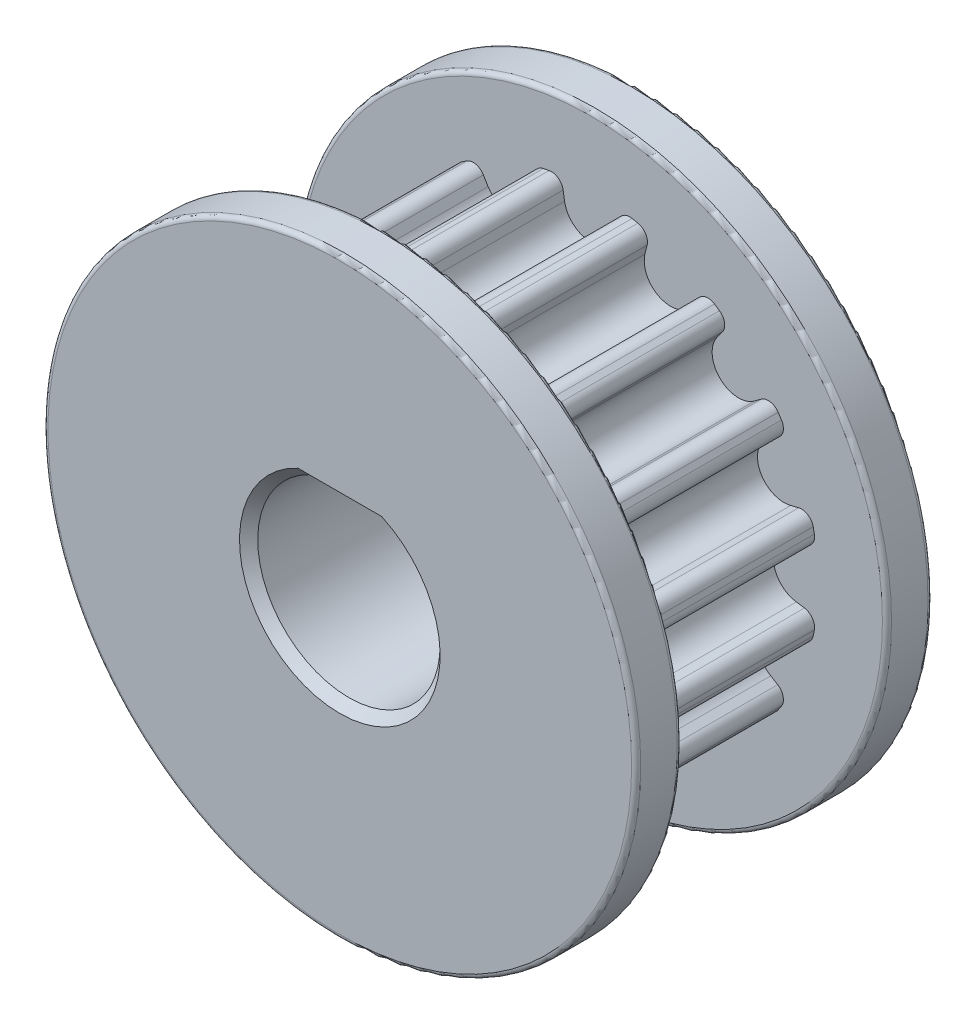
from build123d import *

# Parameters (mm, degrees)
EXTRUDE_3_DEPTH     = 4.5
SKETCH_5_R          = 6.5
EXTRUDE_4_DEPTH     = 1
EXTRUDE_START       = -5.5
SKETCH_5_2_R        = 6.5
EXTRUDE_6_DEPTH     = 1
CUT_EXTRUDE_1_REACH = 13.258
CHAMFER_1_SIZE      = 0.2
FILLET_1_R          = 0.1


with BuildPart() as part:
    # 草图1 → 凸台-拉伸3 (new body)
    with BuildSketch(Plane.XY):
        with BuildLine():
            Line((0.973500707, 4.894118549), (1.037379867, 4.881412194))
            ThreePointArc((1.037379867, 4.881412194), (1.206083752, 4.765877122), (1.239075855, 4.564082984))
            Line((1.239075855, 4.564082984), (1.190890986, 4.368931892))
            ThreePointArc((1.190890986, 4.368931892), (1.544766642, 3.700642421), (2.258591893, 3.950226689))
            Line((2.258591893, 3.950226689), (2.351135088, 4.103452967))
            ThreePointArc((2.351135088, 4.103452967), (2.517154032, 4.222814031), (2.718141325, 4.185218003))
            Line((2.718141325, 4.185218003), (2.772295463, 4.149033365))
            Line((2.772295463, 4.149033365), (2.8264496, 4.112848728))
            ThreePointArc((2.8264496, 4.112848728), (2.938098308, 3.941548058), (2.891355764, 3.742489052))
            Line((2.891355764, 3.742489052), (2.77215766, 3.580632503))
            ThreePointArc((2.77215766, 3.580632503), (2.843352827, 2.827791189), (3.59835313, 2.785207889))
            Line((3.59835313, 2.785207889), (3.742489052, 2.891355764))
            ThreePointArc((3.742489052, 2.891355764), (3.941548058, 2.938098308), (4.112848728, 2.8264496))
            Line((4.112848728, 2.8264496), (4.149033365, 2.772295463))
            Line((4.149033365, 2.772295463), (4.185218003, 2.718141325))
            ThreePointArc((4.185218003, 2.718141325), (4.222814031, 2.517154032), (4.103452967, 2.351135088))
            Line((4.103452967, 2.351135088), (3.931388459, 2.247214275))
            ThreePointArc((3.931388459, 2.247214275), (3.709064318, 1.524434383), (4.390297723, 1.196166436))
            Line((4.390297723, 1.196166436), (4.564082984, 1.239075855))
            ThreePointArc((4.564082984, 1.239075855), (4.765877122, 1.206083752), (4.881412194, 1.037379867))
            Line((4.881412194, 1.037379867), (4.894118549, 0.973500707))
            Line((4.894118549, 0.973500707), (4.906824904, 0.909621546))
            ThreePointArc((4.906824904, 0.909621546), (4.864644598, 0.709546123), (4.690836654, 0.60184212))
            Line((4.690836654, 0.60184212), (4.492101004, 0.571678044))
            ThreePointArc((4.492101004, 0.571678044), (4.010104391, -0.011003739), (4.513859285, -0.574980514))
            Line((4.513859285, -0.574980514), (4.690836654, -0.60184212))
            ThreePointArc((4.690836654, -0.60184212), (4.864644598, -0.709546123), (4.906824904, -0.909621546))
            Line((4.906824904, -0.909621546), (4.894118549, -0.973500707))
            Line((4.894118549, -0.973500707), (4.881412194, -1.037379867))
            ThreePointArc((4.881412194, -1.037379867), (4.765877122, -1.206083752), (4.564082984, -1.239075855))
            Line((4.564082984, -1.239075855), (4.368931892, -1.190890986))
            ThreePointArc((4.368931892, -1.190890986), (3.700642421, -1.544766642), (3.950226689, -2.258591893))
            Line((3.950226689, -2.258591893), (4.103452967, -2.351135088))
            ThreePointArc((4.103452967, -2.351135088), (4.222814031, -2.517154032), (4.185218003, -2.718141325))
            Line((4.185218003, -2.718141325), (4.149033365, -2.772295463))
            Line((4.149033365, -2.772295463), (4.112848728, -2.8264496))
            ThreePointArc((4.112848728, -2.8264496), (3.941548058, -2.938098308), (3.742489052, -2.891355764))
            Line((3.742489052, -2.891355764), (3.580632503, -2.77215766))
            ThreePointArc((3.580632503, -2.77215766), (2.827791189, -2.843352827), (2.785207889, -3.59835313))
            Line((2.785207889, -3.59835313), (2.891355764, -3.742489052))
            ThreePointArc((2.891355764, -3.742489052), (2.938098308, -3.941548058), (2.8264496, -4.112848728))
            Line((2.8264496, -4.112848728), (2.772295463, -4.149033365))
            Line((2.772295463, -4.149033365), (2.718141325, -4.185218003))
            ThreePointArc((2.718141325, -4.185218003), (2.517154032, -4.222814031), (2.351135088, -4.103452967))
            Line((2.351135088, -4.103452967), (2.247214275, -3.931388459))
            ThreePointArc((2.247214275, -3.931388459), (1.524434383, -3.709064318), (1.196166436, -4.390297723))
            Line((1.196166436, -4.390297723), (1.239075855, -4.564082984))
            ThreePointArc((1.239075855, -4.564082984), (1.206083752, -4.765877122), (1.037379867, -4.881412194))
            Line((1.037379867, -4.881412194), (0.973500707, -4.894118549))
            Line((0.973500707, -4.894118549), (0.909621546, -4.906824904))
            ThreePointArc((0.909621546, -4.906824904), (0.709546123, -4.864644598), (0.60184212, -4.690836654))
            Line((0.60184212, -4.690836654), (0.571678044, -4.492101004))
            ThreePointArc((0.571678044, -4.492101004), (-0.011003739, -4.010104391), (-0.574980514, -4.513859285))
            Line((-0.574980514, -4.513859285), (-0.60184212, -4.690836654))
            ThreePointArc((-0.60184212, -4.690836654), (-0.709546123, -4.864644598), (-0.909621546, -4.906824904))
            Line((-0.909621546, -4.906824904), (-0.973500707, -4.894118549))
            Line((-0.973500707, -4.894118549), (-1.037379867, -4.881412194))
            ThreePointArc((-1.037379867, -4.881412194), (-1.206083752, -4.765877122), (-1.239075855, -4.564082984))
            Line((-1.239075855, -4.564082984), (-1.190890986, -4.368931892))
            ThreePointArc((-1.190890986, -4.368931892), (-1.544766642, -3.700642421), (-2.258591893, -3.950226689))
            Line((-2.258591893, -3.950226689), (-2.351135088, -4.103452967))
            ThreePointArc((-2.351135088, -4.103452967), (-2.517154032, -4.222814031), (-2.718141325, -4.185218003))
            Line((-2.718141325, -4.185218003), (-2.772295463, -4.149033365))
            Line((-2.772295463, -4.149033365), (-2.8264496, -4.112848728))
            ThreePointArc((-2.8264496, -4.112848728), (-2.938098308, -3.941548058), (-2.891355764, -3.742489052))
            Line((-2.891355764, -3.742489052), (-2.77215766, -3.580632503))
            ThreePointArc((-2.77215766, -3.580632503), (-2.843352827, -2.827791189), (-3.59835313, -2.785207889))
            Line((-3.59835313, -2.785207889), (-3.742489052, -2.891355764))
            ThreePointArc((-3.742489052, -2.891355764), (-3.941548058, -2.938098308), (-4.112848728, -2.8264496))
            Line((-4.112848728, -2.8264496), (-4.149033365, -2.772295463))
            Line((-4.149033365, -2.772295463), (-4.185218003, -2.718141325))
            ThreePointArc((-4.185218003, -2.718141325), (-4.222814031, -2.517154032), (-4.103452967, -2.351135088))
            Line((-4.103452967, -2.351135088), (-3.931388459, -2.247214275))
            ThreePointArc((-3.931388459, -2.247214275), (-3.709064318, -1.524434383), (-4.390297723, -1.196166436))
            Line((-4.390297723, -1.196166436), (-4.564082984, -1.239075855))
            ThreePointArc((-4.564082984, -1.239075855), (-4.765877122, -1.206083752), (-4.881412194, -1.037379867))
            Line((-4.881412194, -1.037379867), (-4.894118549, -0.973500707))
            Line((-4.894118549, -0.973500707), (-4.906824904, -0.909621546))
            ThreePointArc((-4.906824904, -0.909621546), (-4.864644598, -0.709546123), (-4.690836654, -0.60184212))
            Line((-4.690836654, -0.60184212), (-4.492101004, -0.571678044))
            ThreePointArc((-4.492101004, -0.571678044), (-4.010104391, 0.011003739), (-4.513859285, 0.574980514))
            Line((-4.513859285, 0.574980514), (-4.690836654, 0.60184212))
            ThreePointArc((-4.690836654, 0.60184212), (-4.864644598, 0.709546123), (-4.906824904, 0.909621546))
            Line((-4.906824904, 0.909621546), (-4.894118549, 0.973500707))
            Line((-4.894118549, 0.973500707), (-4.881412194, 1.037379867))
            ThreePointArc((-4.881412194, 1.037379867), (-4.765877122, 1.206083752), (-4.564082984, 1.239075855))
            Line((-4.564082984, 1.239075855), (-4.368931892, 1.190890986))
            ThreePointArc((-4.368931892, 1.190890986), (-3.700642421, 1.544766642), (-3.950226689, 2.258591893))
            Line((-3.950226689, 2.258591893), (-4.103452967, 2.351135088))
            ThreePointArc((-4.103452967, 2.351135088), (-4.222814031, 2.517154032), (-4.185218003, 2.718141325))
            Line((-4.185218003, 2.718141325), (-4.149033365, 2.772295463))
            Line((-4.149033365, 2.772295463), (-4.112848728, 2.8264496))
            ThreePointArc((-4.112848728, 2.8264496), (-3.941548058, 2.938098308), (-3.742489052, 2.891355764))
            Line((-3.742489052, 2.891355764), (-3.580632503, 2.77215766))
            ThreePointArc((-3.580632503, 2.77215766), (-2.827791189, 2.843352827), (-2.785207889, 3.59835313))
            Line((-2.785207889, 3.59835313), (-2.891355764, 3.742489052))
            ThreePointArc((-2.891355764, 3.742489052), (-2.938098308, 3.941548058), (-2.8264496, 4.112848728))
            Line((-2.8264496, 4.112848728), (-2.772295463, 4.149033365))
            Line((-2.772295463, 4.149033365), (-2.718141325, 4.185218003))
            ThreePointArc((-2.718141325, 4.185218003), (-2.517154032, 4.222814031), (-2.351135088, 4.103452967))
            Line((-2.351135088, 4.103452967), (-2.247214275, 3.931388459))
            ThreePointArc((-2.247214275, 3.931388459), (-1.524434383, 3.709064318), (-1.196166436, 4.390297723))
            Line((-1.196166436, 4.390297723), (-1.239075855, 4.564082984))
            ThreePointArc((-1.239075855, 4.564082984), (-1.206083752, 4.765877122), (-1.037379867, 4.881412194))
            Line((-1.037379867, 4.881412194), (-0.973500707, 4.894118549))
            Line((-0.973500707, 4.894118549), (-0.909621546, 4.906824904))
            ThreePointArc((-0.909621546, 4.906824904), (-0.709546123, 4.864644598), (-0.60184212, 4.690836654))
            Line((-0.60184212, 4.690836654), (-0.571678044, 4.492101004))
            ThreePointArc((-0.571678044, 4.492101004), (0.011003739, 4.010104391), (0.574980514, 4.513859285))
            Line((0.574980514, 4.513859285), (0.60184212, 4.690836654))
            ThreePointArc((0.60184212, 4.690836654), (0.709546123, 4.864644598), (0.909621546, 4.906824904))
            Line((0.909621546, 4.906824904), (0.973500707, 4.894118549))
        make_face()
    extrude(amount=EXTRUDE_3_DEPTH)

    # 草图5 → 凸台-拉伸4 (add)
    with BuildSketch(Plane.XY.offset(4.5)):
        Circle(SKETCH_5_R)
    extrude(amount=EXTRUDE_4_DEPTH)

    # 草图5<2> → 凸台-拉伸6 (add)
    with BuildSketch(Plane.XY.offset(4.5).offset(EXTRUDE_START)):
        Circle(SKETCH_5_2_R)
    extrude(amount=EXTRUDE_6_DEPTH)

    # 草图6 → 切除-拉伸1 (cut, up to next)
    with BuildSketch(Plane.XY.offset(5.5), mode=Mode.PRIVATE) as cut_extrude_1_sk1:
        with BuildLine():
            Line((-0.871779789, 1.8), (0.871779789, 1.8))
            ThreePointArc((0.871779789, 1.8), (0, -2), (-0.871779789, 1.8))
        make_face()
    cut_extrude_1_tool1 = extrude(cut_extrude_1_sk1.sketch, amount=-CUT_EXTRUDE_1_REACH, mode=Mode.PRIVATE) & part.part
    add(cut_extrude_1_tool1.solids().sort_by_distance((0, -0.035819, 5.5))[0], mode=Mode.SUBTRACT)

    # 倒角1
    chamfer_1_edges = [part.edges().sort_by_distance(p)[0] for p in [
        (0, 1.8, -1),
        (0, -2, -1),
        (0, 1.8, 5.5),
        (0, -2, 5.5),
    ]]
    chamfer(chamfer_1_edges, length=CHAMFER_1_SIZE)

    # 圆角1
    fillet_1_edges = [part.edges().sort_by_distance(p)[0] for p in [
        (-6.5, 0, -1),
        (-6.5, 0, 0),
        (-6.5, 0, 4.5),
        (-6.5, 0, 5.5),
    ]]
    fillet(fillet_1_edges, radius=FILLET_1_R)


solid = part.part
